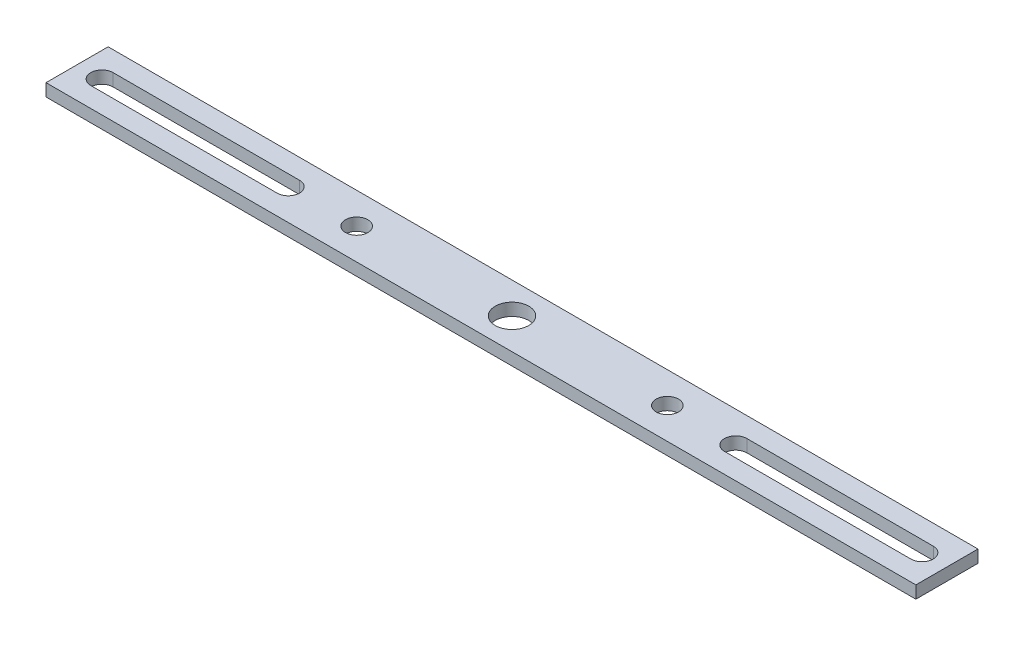
from build123d import *

# Parameters (mm, degrees)
SKETCH1_W           = 177.8
SKETCH1_H           = 12.7
SKETCH1_R           = 3.429
SKETCH1_R_2         = 2.286
BOSS_EXTRUDE1_DEPTH = 2.54


with BuildPart() as part:
    # Sketch1 → Boss-Extrude1 (new body)
    with BuildSketch(Plane(origin=(0, 0, 0), x_dir=(1, 0, 0), z_dir=(0, 1, 0))):
        Rectangle(SKETCH1_W, SKETCH1_H)
        with Locations(Location((0, 0, 0), (0, 0, 270))):
            Circle(SKETCH1_R, mode=Mode.SUBTRACT)
        with Locations(Location((-31.75, 0, 0), (0, 0, 270))):
            Circle(SKETCH1_R_2, mode=Mode.SUBTRACT)
        with Locations(Location((31.75, 0, 0), (0, 0, 270))):
            Circle(SKETCH1_R_2, mode=Mode.SUBTRACT)
        with BuildLine():
            Line((-83.82, 2.286), (-45.72, 2.286))
            ThreePointArc((-45.72, 2.286), (-43.434, 0), (-45.72, -2.286))
            Line((-45.72, -2.286), (-83.82, -2.286))
            ThreePointArc((-83.82, -2.286), (-86.106, 0), (-83.82, 2.286))
        make_face(mode=Mode.SUBTRACT)
        with BuildLine():
            Line((83.82, -2.286), (45.72, -2.286))
            ThreePointArc((45.72, -2.286), (43.434, 0), (45.72, 2.286))
            Line((45.72, 2.286), (83.82, 2.286))
            ThreePointArc((83.82, 2.286), (86.106, 0), (83.82, -2.286))
        make_face(mode=Mode.SUBTRACT)
    extrude(amount=BOSS_EXTRUDE1_DEPTH)


solid = part.part
